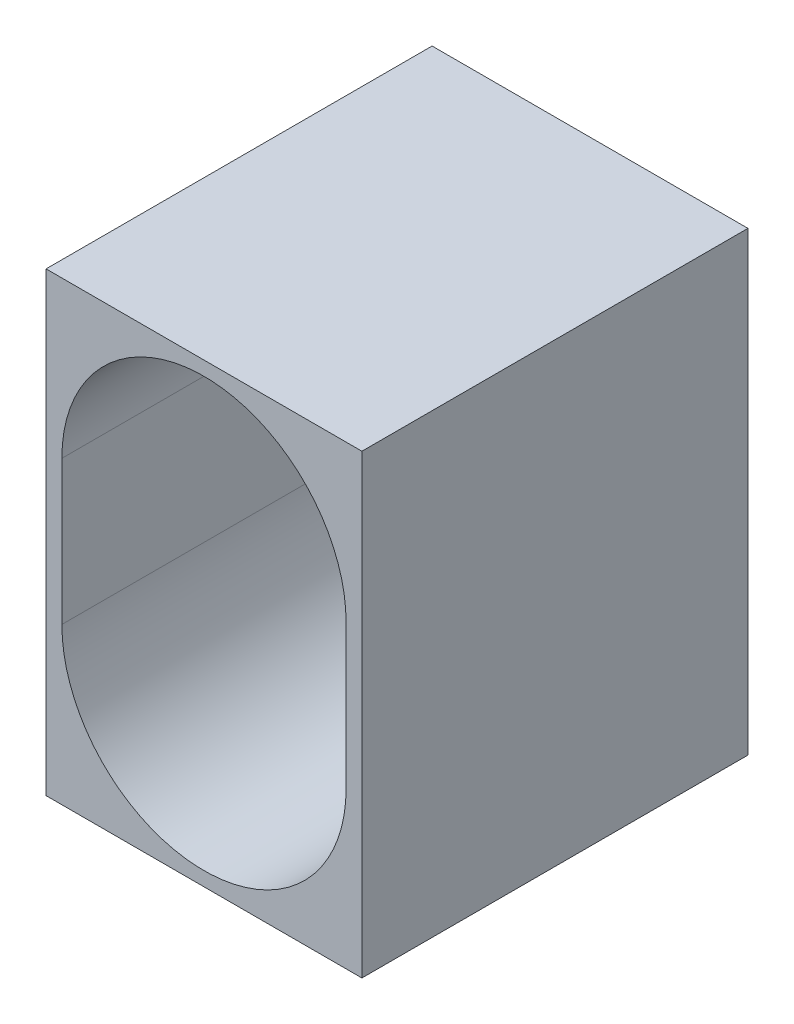
from build123d import *

# Parameters (mm, degrees)
SKETCH4_W                 = 45
SKETCH4_H                 = 65
BOSS_EXTRUDE2_DEPTH       = 55
CUT_EXTRUDE1_DEPTH        = 52.5
F_1_4_28_TAPPED_HOLE1_D   = 5.4102
M2X0_4_TAPPED_HOLE1_D     = 1.6
M2X0_4_TAPPED_HOLE1_DEPTH = 8
M2X0_4_TAPPED_HOLE1_TIP   = 0.480688495
M2X0_4_TAPPED_HOLE2_D     = 1.6
M2X0_4_TAPPED_HOLE2_DEPTH = 8
M2X0_4_TAPPED_HOLE2_TIP   = 0.480688495


with BuildPart() as part:
    # Sketch4 → Boss-Extrude2 (new body)
    with BuildSketch(Plane.XY):
        with Locations((-7.784904398, -11.939291809)):
            Rectangle(SKETCH4_W, SKETCH4_H)
    extrude(amount=BOSS_EXTRUDE2_DEPTH)

    # Sketch5 → Cut-Extrude1 (cut)
    with BuildSketch(Plane.XY.offset(55)):
        with BuildLine():
            Line((-28.034904398, -22.189291809), (-28.034904398, -1.689291809))
            ThreePointArc((-28.034904398, -1.689291809), (-7.784904398, 18.560708191), (12.465095602, -1.689291809))
            Line((12.465095602, -1.689291809), (12.465095602, -22.189291809))
            ThreePointArc((12.465095602, -22.189291809), (-7.784904398, -42.439291809), (-28.034904398, -22.189291809))
        make_face()
    extrude(amount=-CUT_EXTRUDE1_DEPTH, mode=Mode.SUBTRACT)

    # 1/4-28 Tapped Hole1 (through all)
    with Locations(Plane(origin=(0, 0, 0), x_dir=(-1, 0, 0), z_dir=(0, 0, -1))):
        with Locations((7.784904398, -16.439291809)):
            Hole(F_1_4_28_TAPPED_HOLE1_D / 2)

    # M2x0.4 Tapped Hole1
    with Locations(Plane(origin=(0, 0, 0), x_dir=(-1, 0, 0), z_dir=(0, 0, -1))):
        with Locations((-10.715095602, -40.439291809)):
            Hole(M2X0_4_TAPPED_HOLE1_D / 2, depth=M2X0_4_TAPPED_HOLE1_DEPTH)
            with Locations((0, 0, -(M2X0_4_TAPPED_HOLE1_DEPTH + M2X0_4_TAPPED_HOLE1_TIP / 2))):  # 118° drill point
                Cone(0, M2X0_4_TAPPED_HOLE1_D / 2, M2X0_4_TAPPED_HOLE1_TIP, mode=Mode.SUBTRACT)

    # M2x0.4 Tapped Hole2
    with Locations(Plane(origin=(-26.284904398, -40.439291809, 0), x_dir=(-1, 0, 0), z_dir=(0, 0, -1))):
        with Locations((0, 0)):
            Hole(M2X0_4_TAPPED_HOLE2_D / 2, depth=M2X0_4_TAPPED_HOLE2_DEPTH)
            with Locations((0, 0, -(M2X0_4_TAPPED_HOLE2_DEPTH + M2X0_4_TAPPED_HOLE2_TIP / 2))):  # 118° drill point
                Cone(0, M2X0_4_TAPPED_HOLE2_D / 2, M2X0_4_TAPPED_HOLE2_TIP, mode=Mode.SUBTRACT)


solid = part.part
